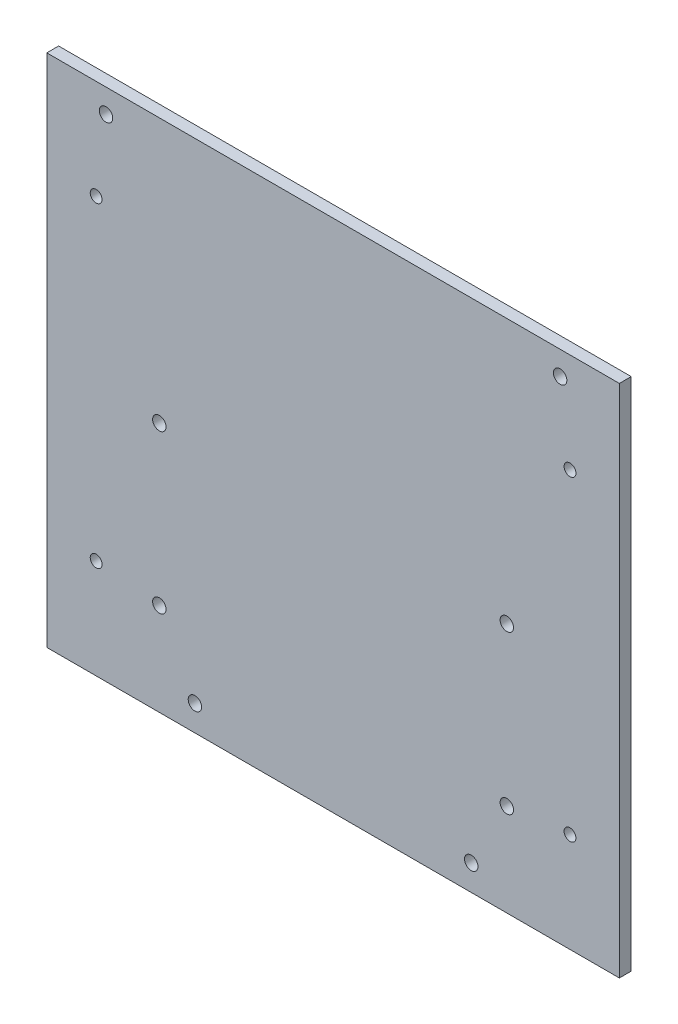
from build123d import *

# Parameters (mm, degrees)
SKETCH1_W             = 145
SKETCH1_H             = 130.4
SKETCH1_R             = 1.5
BOSS_EXTRUDE1_DEPTH   = 3
SKETCH3_R             = 1.7
DEPENDENT_HOLES_DEPTH = 10


with BuildPart() as part:
    # Sketch1 → Boss-Extrude1 (new body)
    with BuildSketch(Plane.XY):
        with Locations((0, 65.2)):
            Rectangle(SKETCH1_W, SKETCH1_H)
        with Locations((-60, 105.2)):
            Circle(SKETCH1_R, mode=Mode.SUBTRACT)
        with Locations((60, 105.2)):
            Circle(SKETCH1_R, mode=Mode.SUBTRACT)
        with Locations((60, 25.2)):
            Circle(SKETCH1_R, mode=Mode.SUBTRACT)
        with Locations((-60, 25.2)):
            Circle(SKETCH1_R, mode=Mode.SUBTRACT)
    extrude(amount=BOSS_EXTRUDE1_DEPTH)

    # Sketch3 → dependent_holes (cut)
    with BuildSketch(Plane.XY.offset(3)):
        with Locations((-57.5, 124.4)):
            Circle(SKETCH3_R)
        with Locations((57.5, 124.4)):
            Circle(SKETCH3_R)
        with Locations((-44, 63.438804225)):
            Circle(SKETCH3_R)
        with Locations((-44, 23.438804225)):
            Circle(SKETCH3_R)
        with Locations((44, 23.438804225)):
            Circle(SKETCH3_R)
        with Locations((44, 63.438804225)):
            Circle(SKETCH3_R)
        with Locations((-34.9875, 6.5)):
            Circle(SKETCH3_R)
        with Locations((34.9875, 6.5)):
            Circle(SKETCH3_R)
    extrude(amount=-DEPENDENT_HOLES_DEPTH, mode=Mode.SUBTRACT)


solid = part.part
